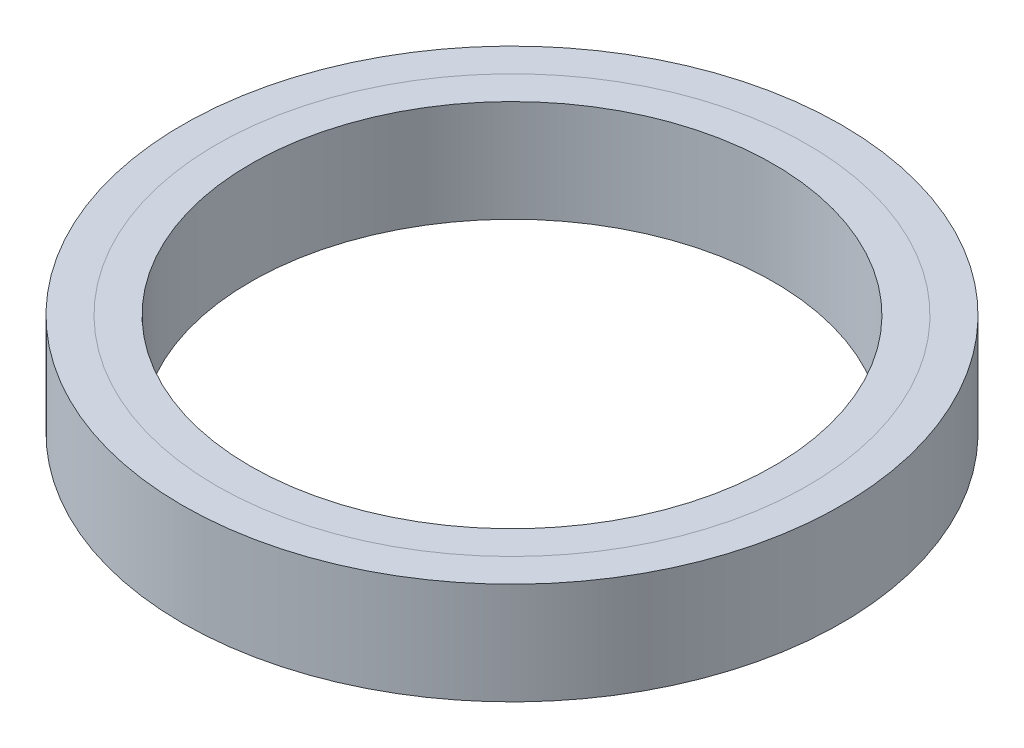
from build123d import *

# Parameters (mm, degrees)
SKETCH_2_R      = 43.5
SKETCH_2_R_2    = 38.5
EXTRUDE_1_DEPTH = 7.5
SKETCH_3_R      = 48.5
SKETCH_3_R_2    = 43.5
EXTRUDE_2_DEPTH = 7.5


with BuildPart() as part:
    # 草图2 → 凸台-拉伸1 (new, symmetric)
    with BuildSketch(Plane(origin=(0, 0, 0), x_dir=(1, 0, 0), z_dir=(0, 1, 0))):
        with Locations(Location((0, 0, 0), (0, 0, 270))):
            Circle(SKETCH_2_R)
        with Locations(Location((0, 0, 0), (0, 0, 270))):
            Circle(SKETCH_2_R_2, mode=Mode.SUBTRACT)
    extrude(amount=EXTRUDE_1_DEPTH, both=True)


with BuildPart() as body_2:
    # 草图3 → 凸台-拉伸2 (new, symmetric)
    with BuildSketch(Plane(origin=(0, 0, 0), x_dir=(1, 0, 0), z_dir=(0, 1, 0))):
        with Locations(Location((0, 0, 0), (0, 0, 270))):
            Circle(SKETCH_3_R)
        with Locations(Location((0, 0, 0), (0, 0, 270))):
            Circle(SKETCH_3_R_2, mode=Mode.SUBTRACT)
    extrude(amount=EXTRUDE_2_DEPTH, both=True)


solid = Compound([part.part, body_2.part])
